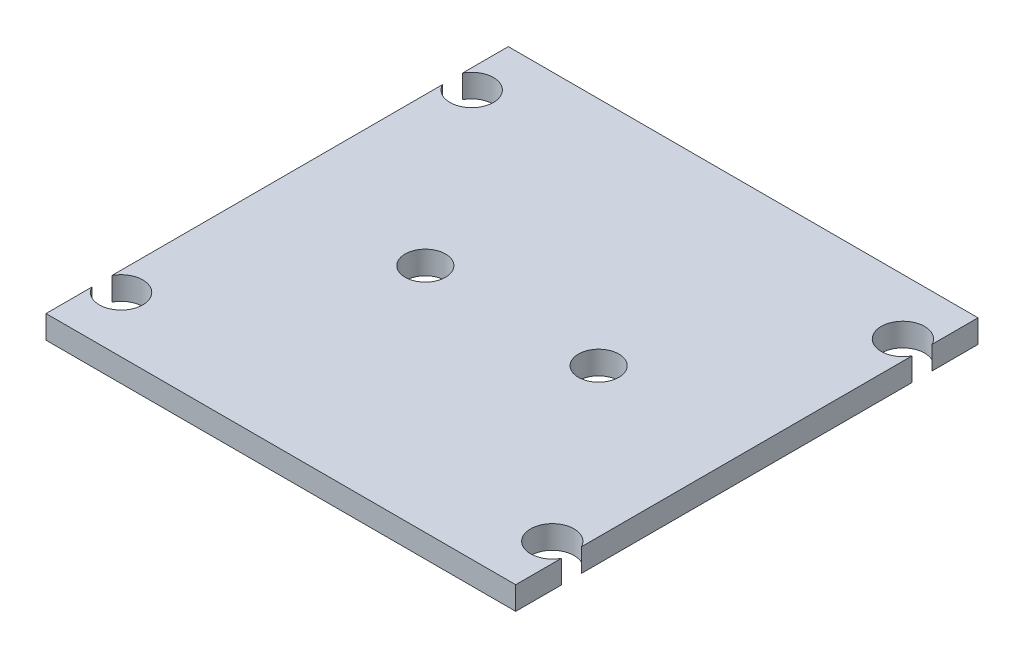
from build123d import *

# Parameters (mm, degrees)
SKETCH1_W               = 40.64
SKETCH1_H               = 39.9999962
BOSS_EXTRUDE1_DEPTH     = 1.999996
CUT_EXTRUDE1_DEPTH      = 29.5815029
CUT_EXTRUDE1_DEPTH_BACK = 29.5815029
SKETCH2_R               = 1.877518959
SKETCH2_R_2             = 1.749160226


with BuildPart() as part:
    # Sketch1 → Boss-Extrude1 (new body)
    with BuildSketch(Plane(origin=(0, 0, 0), x_dir=(1, 0, 0), z_dir=(0, 1, 0))):
        Rectangle(SKETCH1_W, SKETCH1_H)
    extrude(amount=BOSS_EXTRUDE1_DEPTH)

    # Sketch2 → Cut-Extrude1 (cut, two sides: drawn at the far end of the back side and taken through both)
    with BuildSketch(Plane(origin=(0, 1.999996, 0), x_dir=(1, 0, 0), z_dir=(0, 1, 0)).offset(-CUT_EXTRUDE1_DEPTH_BACK)):
        with Locations((-18.654170648, 15.167488224)):
            Circle(SKETCH2_R)
        with Locations((-18.654170648, -15.167488224)):
            Circle(SKETCH2_R)
        with Locations((18.654170648, -15.167488224)):
            Circle(SKETCH2_R)
        with Locations((18.654170648, 15.167488224)):
            Circle(SKETCH2_R)
        with Locations(Location((-7.497989174, 0, 0), (0, 0, 270))):
            Circle(SKETCH2_R_2)
        with Locations(Location((7.497989174, 0, 0), (0, 0, 90))):
            Circle(SKETCH2_R_2)
    extrude(amount=CUT_EXTRUDE1_DEPTH + CUT_EXTRUDE1_DEPTH_BACK, mode=Mode.SUBTRACT)


solid = part.part
